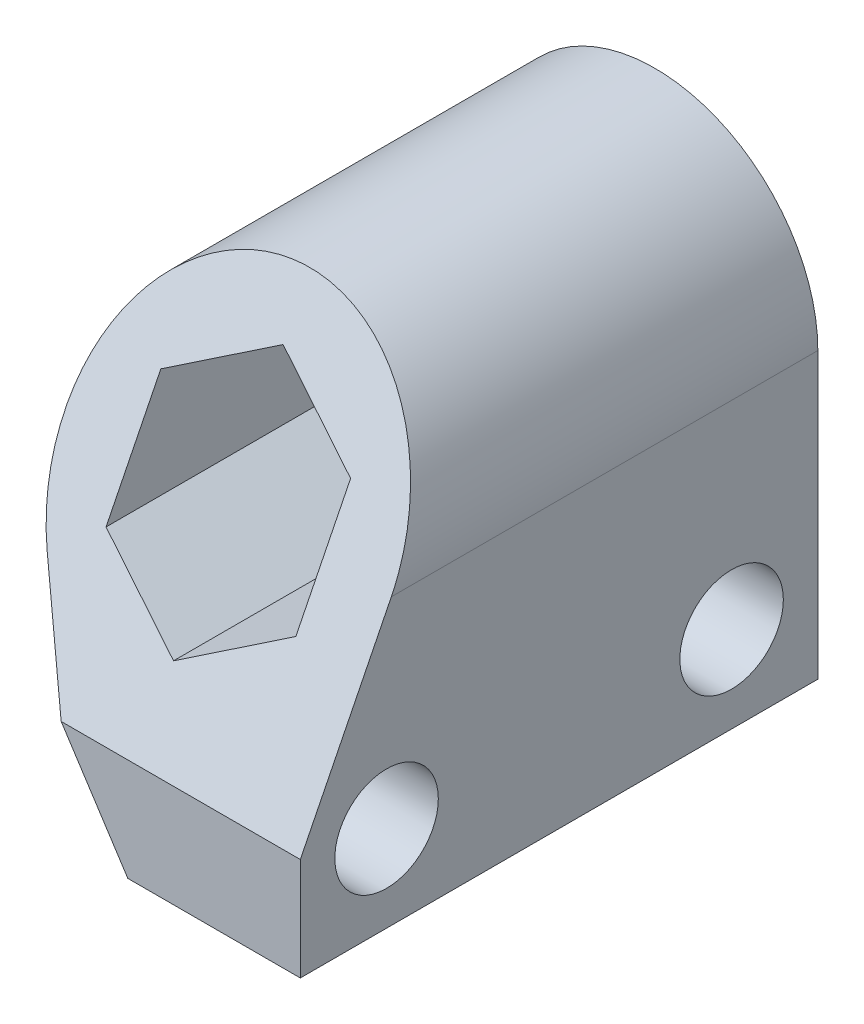
from build123d import *

# Parameters (mm, degrees)
BOSS_EXTRUDE1_DEPTH = 9.525
CUT_EXTRUDE1_DEPTH  = 19.560809014
SKETCH3_R           = 1.905
CUT_EXTRUDE2_DEPTH  = 19.560809014


with BuildPart() as part:
    # Sketch1 → Boss-Extrude1 (new, symmetric)
    with BuildSketch(Plane.XY):
        with BuildLine():
            Line((6, 0), (6, -10.4775))
            Line((6, -10.4775), (-0.35, -10.4775))
            Line((-0.35, -10.4775), (-5.032019678, -3.267839953))
            ThreePointArc((-5.032019678, -3.267839953), (-1.704095351, 5.752917437), (6, 0))
        make_face()
        Polygon((3.4925, -2.016395815), (3.4925, 2.016395815), (0, 4.03279163), (-3.4925, 2.016395815), (-3.4925, -2.016395815), (0, -4.03279163), align=None, mode=Mode.SUBTRACT)
    extrude(amount=BOSS_EXTRUDE1_DEPTH, both=True)

    # Sketch2 → Cut-Extrude1 (cut, through all)
    with BuildSketch(Plane(origin=(6, 0, 0), x_dir=(0, 0, -1), z_dir=(1, 0, 0))):
        Polygon((-3.175, 6), (-9.525, -6.7), (-9.525, 6), align=None)
    extrude(amount=-CUT_EXTRUDE1_DEPTH, mode=Mode.SUBTRACT)

    # Sketch3 → Cut-Extrude2 (cut, through all)
    with BuildSketch(Plane(origin=(6, 0, 0), x_dir=(0, 0, -1), z_dir=(1, 0, 0))):
        with Locations((-6.35, -7.3025)):
            Circle(SKETCH3_R)
        with Locations((6.35, -7.3025)):
            Circle(SKETCH3_R)
    extrude(amount=-CUT_EXTRUDE2_DEPTH, mode=Mode.SUBTRACT)


solid = part.part
